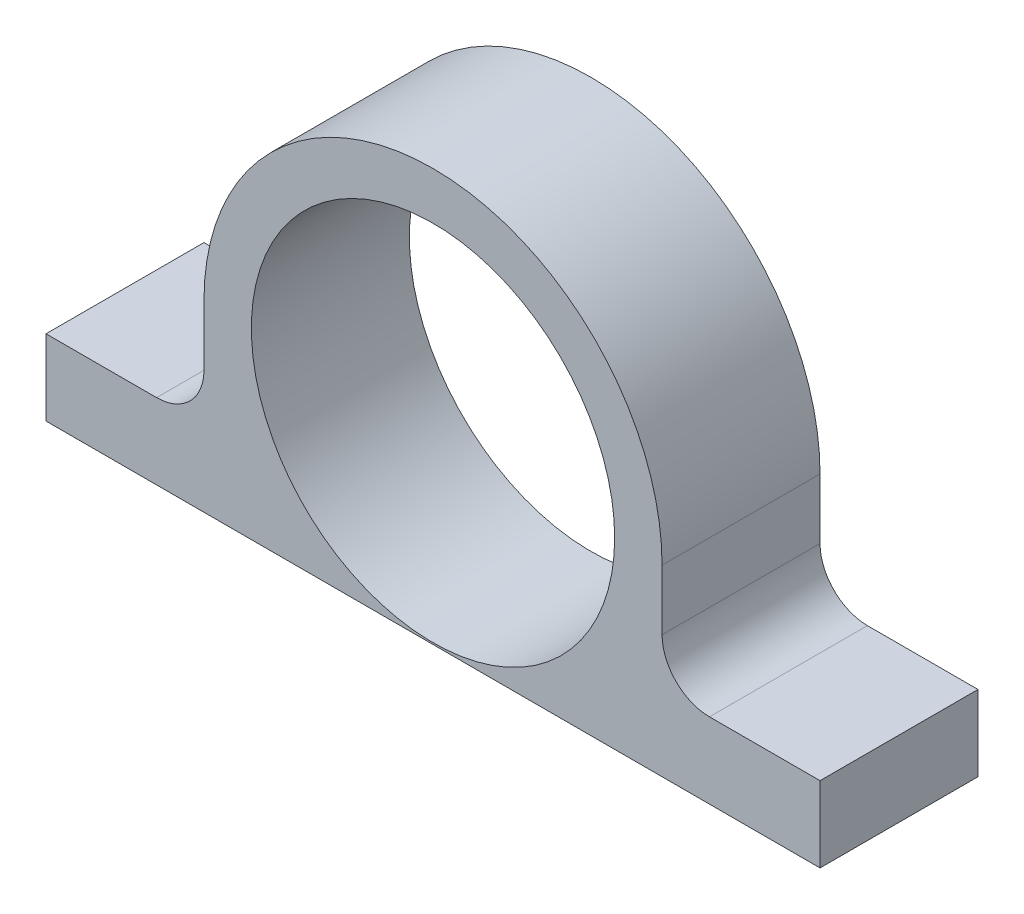
from build123d import *

# Parameters (mm, degrees)
BOSS_EXTRUDE1_DEPTH = 10


with BuildPart() as part:
    # Sketch1 → Boss-Extrude1 (new body)
    with BuildSketch(Plane.XY):
        with BuildLine():
            Line((17.5, 78.07327943), (24.5, 78.07327943))
            Line((24.5, 78.07327943), (24.5, 73.287247591))
            Line((24.5, 73.287247591), (-24.5, 73.287247591))
            Line((-24.5, 73.287247591), (-24.5, 78.07327943))
            Line((-24.5, 78.07327943), (-17.5, 78.07327943))
            ThreePointArc((-17.5, 78.07327943), (-15.378679656, 78.951959087), (-14.5, 81.07327943))
            Line((-14.5, 81.07327943), (-14.5, 84.887247591))
            ThreePointArc((-14.5, 84.887247591), (0, 99.387247591), (14.5, 84.887247591))
            Line((14.5, 84.887247591), (14.5, 81.07327943))
            ThreePointArc((14.5, 81.07327943), (15.378679656, 78.951959087), (17.5, 78.07327943))
        make_face()
        with BuildLine():
            ThreePointArc((11.5, 84.887247591), (0, 96.387247591), (-11.5, 84.887247591))
            ThreePointArc((-11.5, 84.887247591), (0, 73.387247591), (11.5, 84.887247591))
        make_face(mode=Mode.SUBTRACT)
    extrude(amount=BOSS_EXTRUDE1_DEPTH)


solid = part.part
